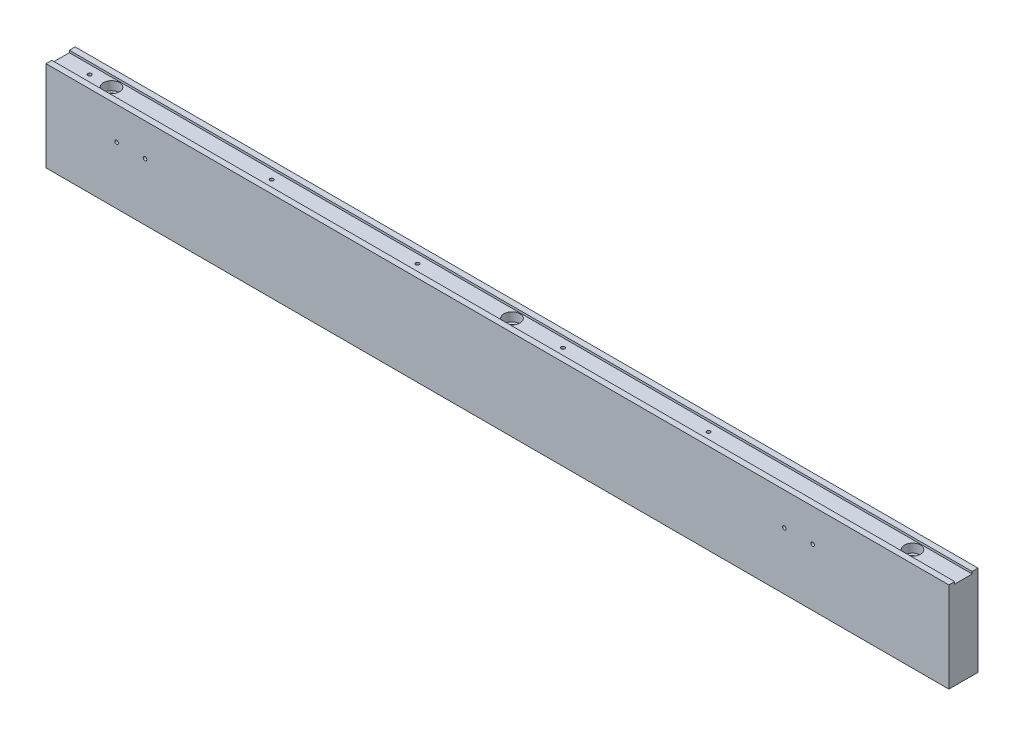
from build123d import *

# Parameters (mm, degrees)
SKETCH_1_W                   = 620
SKETCH_1_H                   = 62
EXTRUDE_1_DEPTH              = 20
SKETCH_2_W                   = 12
SKETCH_2_H                   = 1.5
CUT_EXTRUDE_1_DEPTH          = 624.413185616
HOLE_WIZARD_M6_1_D           = 7
HOLE_WIZARD_M6_1_CBORE_D     = 11
HOLE_WIZARD_M6_1_CBORE_DEPTH = 6
HOLE_WIZARD_M3_1_D           = 2.5
HOLE_WIZARD_M3_1_DEPTH       = 7.5
HOLE_WIZARD_M3_1_TIP         = 0.751075774
HOLE_WIZARD_M3_2_D           = 2.5
HOLE_WIZARD_M3_2_DEPTH       = 7.5
HOLE_WIZARD_M3_2_TIP         = 0.751075774


with BuildPart() as part:
    # 草图1 → 凸台-拉伸1 (new body)
    with BuildSketch(Plane.XY):
        with Locations((310, 31)):
            Rectangle(SKETCH_1_W, SKETCH_1_H)
    extrude(amount=EXTRUDE_1_DEPTH)

    # 草图2 → 切除-拉伸1 (cut, through all)
    with BuildSketch(Plane(origin=(620, 0, 0), x_dir=(0, 0, -1), z_dir=(1, 0, 0))):
        with Locations((-10, 61.25)):
            Rectangle(SKETCH_2_W, SKETCH_2_H)
    extrude(amount=-CUT_EXTRUDE_1_DEPTH, mode=Mode.SUBTRACT)

    # M6 六角凹头螺钉的柱形沉头孔1 (through all)
    with Locations(Plane(origin=(0, 60.5, 0), x_dir=(-1, 0, 0), z_dir=(0, 1, 0))):
        with Locations((-35, 10), (-310, 10), (-585, 10)):
            CounterBoreHole(HOLE_WIZARD_M6_1_D / 2, HOLE_WIZARD_M6_1_CBORE_D / 2, HOLE_WIZARD_M6_1_CBORE_DEPTH)

    # M3 螺纹孔1
    with Locations(Plane(origin=(0, 60.5, 0), x_dir=(-1, 0, 0), z_dir=(0, 1, 0))):
        with Locations((-20, 10), (-445, 10), (-345, 10), (-245, 10), (-145, 10)):
            Hole(HOLE_WIZARD_M3_1_D / 2, depth=HOLE_WIZARD_M3_1_DEPTH)
            with Locations((0, 0, -(HOLE_WIZARD_M3_1_DEPTH + HOLE_WIZARD_M3_1_TIP / 2))):  # 118° drill point
                Cone(0, HOLE_WIZARD_M3_1_D / 2, HOLE_WIZARD_M3_1_TIP, mode=Mode.SUBTRACT)

    # M3 螺纹孔2
    with Locations(Plane.XY.offset(20)):
        with Locations((48.5, 39.5), (68, 39.5), (507, 39.5), (526.5, 39.5)):
            Hole(HOLE_WIZARD_M3_2_D / 2, depth=HOLE_WIZARD_M3_2_DEPTH)
            with Locations((0, 0, -(HOLE_WIZARD_M3_2_DEPTH + HOLE_WIZARD_M3_2_TIP / 2))):  # 118° drill point
                Cone(0, HOLE_WIZARD_M3_2_D / 2, HOLE_WIZARD_M3_2_TIP, mode=Mode.SUBTRACT)


solid = part.part
